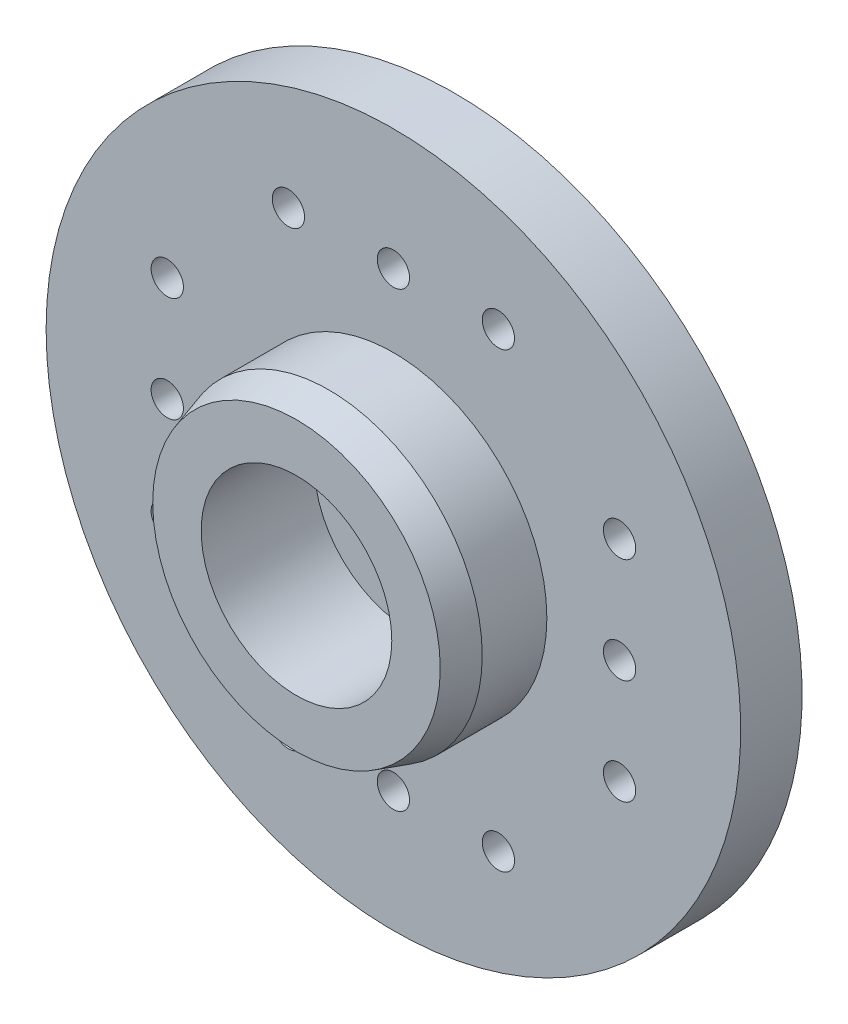
from build123d import *

# Parameters (mm, degrees)
SKETCH1_R           = 10.75
SKETCH1_R_2         = 0.5
BOSS_EXTRUDE1_DEPTH = 1.9
SKETCH2_R           = 4.75
BOSS_EXTRUDE2_DEPTH = 3
SKETCH7_R           = 2.95
CUT_EXTRUDE1_DEPTH  = 3.5
SKETCH8_R           = 3.25
SKETCH8_R_2         = 2.75
BOSS_EXTRUDE3_DEPTH = 1
CUT_EXTRUDE2_START  = -0.4
SKETCH9_R           = 4.25
SKETCH9_R_2         = 3.25
CUT_EXTRUDE2_DEPTH  = 0.4
SKETCH10_R          = 1.45
CUT_EXTRUDE3_DEPTH  = 16.972945877


with BuildPart() as part:
    # Sketch1 → Boss-Extrude1 (new body)
    with BuildSketch(Plane.XY):
        with Locations(Location((0, 0, 0), (0, 0, 180))):
            Circle(SKETCH1_R)
        with Locations((-3.25, 7)):
            Circle(SKETCH1_R_2, mode=Mode.SUBTRACT)
        with Locations((0, 7)):
            Circle(SKETCH1_R_2, mode=Mode.SUBTRACT)
        with Locations((3.25, 7)):
            Circle(SKETCH1_R_2, mode=Mode.SUBTRACT)
        with Locations((7, 3.25)):
            Circle(SKETCH1_R_2, mode=Mode.SUBTRACT)
        with Locations((7, 0)):
            Circle(SKETCH1_R_2, mode=Mode.SUBTRACT)
        with Locations((7, -3.25)):
            Circle(SKETCH1_R_2, mode=Mode.SUBTRACT)
        with Locations((3.25, -7)):
            Circle(SKETCH1_R_2, mode=Mode.SUBTRACT)
        with Locations((0, -7)):
            Circle(SKETCH1_R_2, mode=Mode.SUBTRACT)
        with Locations((-3.25, -7)):
            Circle(SKETCH1_R_2, mode=Mode.SUBTRACT)
        with Locations((-7, -3.25)):
            Circle(SKETCH1_R_2, mode=Mode.SUBTRACT)
        with Locations((-7, 0)):
            Circle(SKETCH1_R_2, mode=Mode.SUBTRACT)
        with Locations((-7, 3.25)):
            Circle(SKETCH1_R_2, mode=Mode.SUBTRACT)
    extrude(amount=BOSS_EXTRUDE1_DEPTH)

    # Sketch2 → Boss-Extrude2 (add)
    with BuildSketch(Plane.XY.offset(1.9)):
        Circle(SKETCH2_R)
    extrude(amount=BOSS_EXTRUDE2_DEPTH)

    # Sketch5 → Cut-Revolve1 (revolve, cut)
    with BuildSketch(Plane(origin=(0, 0, 0), x_dir=(1, 0, 0), z_dir=(0, 1, 0))):
        Polygon((4.75, -3.9), (4.45, -4.9), (4.75, -4.9), align=None)
    revolve(axis=Axis((0, 0, 6.098390295), (0, 0, -1)), mode=Mode.SUBTRACT)

    # Sketch7 → Cut-Extrude1 (cut)
    with BuildSketch(Plane.XY.offset(4.9)):
        Circle(SKETCH7_R)
    extrude(amount=-CUT_EXTRUDE1_DEPTH, mode=Mode.SUBTRACT)

    # Sketch8 → Boss-Extrude3 (add)
    with BuildSketch(Plane(origin=(0, 0, 0), x_dir=(-1, 0, 0), z_dir=(0, 0, -1))):
        with Locations(Location((0, 0, 0), (0, 0, 180))):
            Circle(SKETCH8_R)
        Circle(SKETCH8_R_2, mode=Mode.SUBTRACT)
    extrude(amount=BOSS_EXTRUDE3_DEPTH)

    # Sketch9 → Cut-Extrude2 (cut)
    with BuildSketch(Plane(origin=(0, 0, 0), x_dir=(-1, 0, 0), z_dir=(0, 0, -1)).offset(CUT_EXTRUDE2_START)):
        Circle(SKETCH9_R)
        Circle(SKETCH9_R_2, mode=Mode.SUBTRACT)
    extrude(amount=CUT_EXTRUDE2_DEPTH, mode=Mode.SUBTRACT)

    # Sketch10 → Cut-Extrude3 (cut, through all)
    with BuildSketch(Plane(origin=(0, 0, 0), x_dir=(-1, 0, 0), z_dir=(0, 0, -1))):
        Circle(SKETCH10_R)
    extrude(amount=-CUT_EXTRUDE3_DEPTH, mode=Mode.SUBTRACT)


solid = part.part
